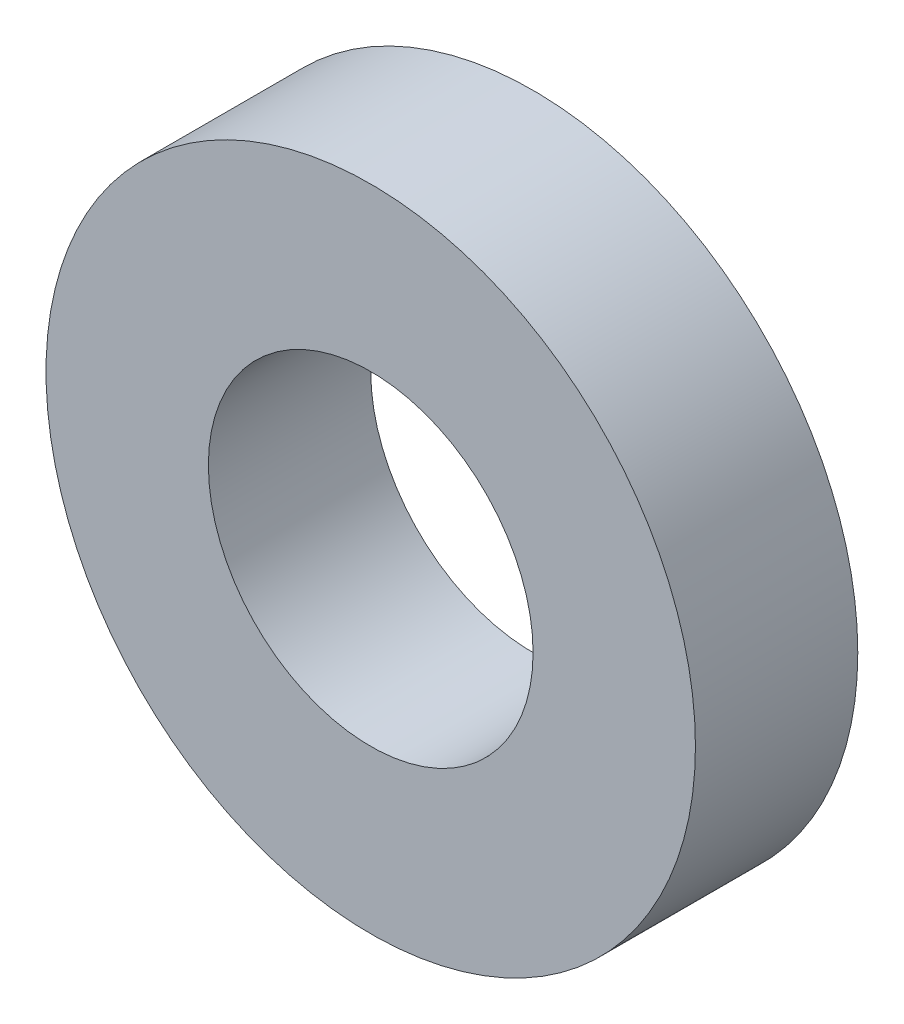
from build123d import *

# Parameters (mm, degrees)
SKETCH1_R           = 25.4
SKETCH1_R_2         = 12.7
BOSS_EXTRUDE1_DEPTH = 12.7


with BuildPart() as part:
    # Sketch1 → Boss-Extrude1 (new body)
    with BuildSketch(Plane.XY):
        Circle(SKETCH1_R)
        Circle(SKETCH1_R_2, mode=Mode.SUBTRACT)
    extrude(amount=BOSS_EXTRUDE1_DEPTH)


solid = part.part
